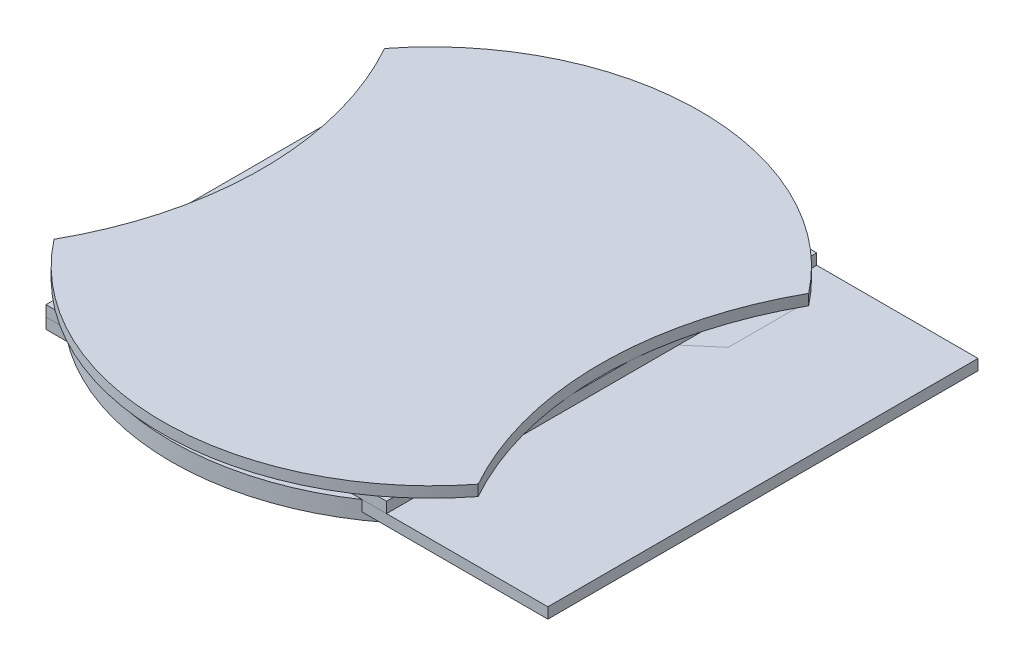
from build123d import *

# Parameters (mm, degrees)
SKETCH1_W                   = 140
SKETCH1_H                   = 120
COMPACT_DEPTH               = 3
SKETCH4_W                   = 95
SKETCH4_H                   = 120
SUPERCOMPACT_DEPTH          = 3
SKETCH7_R                   = 75
APPLE_BASE_DEPTH            = 3
SIDECUTS_DEPTH              = 195.694632694
APPLE_BASE_2_DEPTH          = 3
BOSS_EXTRUDE4_DEPTH         = 3
BASE_PLATE_FILLET_R         = 0.001
TOP_BOTTOM_EXTENSIONS_DEPTH = 3
SKETCH35_R                  = 1.25
SPACERHOLES_DEPTH           = 10
CUT_EXTRUDE4_DEPTH          = 10
SKETCH39_R                  = 72.5
SKETCH39_R_2                = 1.25
BOSS_EXTRUDE5_DEPTH         = 5
CUT_EXTRUDE5_DEPTH          = 150
SKETCH41_R                  = 8.4
CUT_EXTRUDE6_DEPTH          = 10
SKETCH45_R                  = 3.5
CUT_EXTRUDE8_DEPTH          = 12
SKETCH46_R                  = 3.5
CUT_EXTRUDE9_DEPTH          = 10
SKETCH47_R                  = 3.321159562
SKETCH47_R_2                = 3.023678144
SKETCH47_R_3                = 2.802634086
SKETCH47_R_4                = 2.486557649
BOSS_EXTRUDE6_DEPTH         = 5
SKETCH48_R                  = 12.079747328
BOSS_EXTRUDE7_DEPTH         = 5
CUT_EXTRUDE10_DEPTH         = 5
CUT_EXTRUDE11_DEPTH         = 10
BOSS_EXTRUDE9_DEPTH         = 1
BOSS_EXTRUDE9_DEPTH_BACK    = 5
SKETCH52_R                  = 3.9
CHAMFER1_SIZE               = 1
CHAMFER2_SIZE               = 1


with BuildPart() as part:
    # Sketch1 → Compact (new body)
    with BuildSketch(Plane(origin=(0, 0, 0), x_dir=(1, 0, 0), z_dir=(0, 1, 0))):
        with Locations((70, 60)):
            Rectangle(SKETCH1_W, SKETCH1_H)
    extrude(amount=COMPACT_DEPTH)


with BuildPart() as body_2:
    # Sketch4 → SuperCompact (new body)
    with BuildSketch(Plane(origin=(0, 3, 0), x_dir=(1, 0, 0), z_dir=(0, 1, 0))):
        with Locations((47.5, 60)):
            Rectangle(SKETCH4_W, SKETCH4_H)
    extrude(amount=SUPERCOMPACT_DEPTH)


with BuildPart() as body_3:
    # Sketch7 → Apple Base (new body)
    with BuildSketch(Plane(origin=(0, 6, 0), x_dir=(1, 0, 0), z_dir=(0, 1, 0))):
        with Locations(Location((47.5, 60, 0), (0, 0, 270))):
            Circle(SKETCH7_R)
    extrude(amount=APPLE_BASE_DEPTH)

    # Sketch8 → SideCuts (cut, through all)
    with BuildSketch(Plane(origin=(0, 9, 0), x_dir=(1, 0, 0), z_dir=(0, 1, 0))):
        with BuildLine():
            ThreePointArc((-11.66, 106.098746187), (0.350007958, 60), (-11.66, 13.901253813))
            ThreePointArc((-11.66, 13.901253813), (-27.5, 60), (-11.66, 106.098746187))
        make_face()
        with BuildLine():
            ThreePointArc((106.66, 106.098746187), (94.649992042, 60), (106.66, 13.901253813))
            ThreePointArc((106.66, 13.901253813), (122.5, 60), (106.66, 106.098746187))
        make_face()
    extrude(amount=-SIDECUTS_DEPTH, mode=Mode.SUBTRACT)


with BuildPart() as body_4:
    # Sketch9 → Apple_Base 2 (new body)
    with BuildSketch(Plane.XZ.offset(-6)):
        with BuildLine():
            ThreePointArc((106.66, -13.901253813), (47.5, 15), (-11.66, -13.901253813))
            ThreePointArc((-11.66, -13.901253813), (0.350007958, -60), (-11.66, -106.098746187))
            ThreePointArc((-11.66, -106.098746187), (47.5, -135), (106.66, -106.098746187))
            ThreePointArc((106.66, -106.098746187), (94.649992042, -60), (106.66, -13.901253813))
        make_face()
    extrude(amount=APPLE_BASE_2_DEPTH)

    # Sketch10 → Boss-Extrude4 (add)
    with BuildSketch(Plane(origin=(0, 6, 0), x_dir=(1, 0, 0), z_dir=(0, 1, 0))):
        with BuildLine():
            Line((-11.66, 106.098746187), (-11.66, 13.901253813))
            ThreePointArc((-11.66, 13.901253813), (0.350007958, 60), (-11.66, 106.098746187))
        make_face()
        with BuildLine():
            Line((106.66, 106.098746187), (106.66, 13.901253813))
            ThreePointArc((106.66, 13.901253813), (94.649992042, 60), (106.66, 106.098746187))
        make_face()
    extrude(amount=-BOSS_EXTRUDE4_DEPTH)

    # Base_Plate_Fillet
    base_plate_fillet_edges = [body_4.edges().sort_by_distance(p)[0] for p in [
        (-11.66, 3, -60),
        (-11.66, 6, -60),
        (47.5, 3, -135),
        (106.66, 3, -60),
        (106.66, 6, -60),
        (47.5, 6, -135),
        (47.5, 6, 15),
        (106.66, 4.5, -106.098746187),
        (-11.66, 4.5, -106.098746187),
        (-11.66, 4.5, -13.901253813),
        (106.66, 4.5, -13.901253813),
        (47.5, 3, 15),
    ]]
    fillet(base_plate_fillet_edges, radius=BASE_PLATE_FILLET_R)

    # Sketch25 → Top Bottom extensions (add)
    with BuildSketch(Plane(origin=(0, 6, 0), x_dir=(1, 0, 0), z_dir=(0, 1, 0))):
        with BuildLine():
            Line((-11.659005821, 106.097402592), (-11.659005821, 111.097402592))
            ThreePointArc((-11.659005821, 111.097402592), (47.5, 138.794628322), (106.659005821, 111.097402592))
            Line((106.659005821, 111.097402592), (106.659005821, 106.097402592))
            ThreePointArc((106.659005821, 106.097402592), (47.5, 133.794628322), (-11.659005821, 106.097402592))
        make_face()
        with BuildLine():
            Line((106.659005821, 13.902597408), (106.659005821, 8.902597408))
            ThreePointArc((106.659005821, 8.902597408), (47.5, -18.794628322), (-11.659005821, 8.902597408))
            Line((-11.659005821, 8.902597408), (-11.659005821, 13.902597408))
            ThreePointArc((-11.659005821, 13.902597408), (47.5, -13.794628322), (106.659005821, 13.902597408))
        make_face()
    extrude(amount=-TOP_BOTTOM_EXTENSIONS_DEPTH)

    # Sketch35 → SpacerHoles (cut)
    with BuildSketch(Plane.XZ.offset(-3)):
        with Locations(Location((7.5, -5.15, 0), (0, 0, 270))):
            Circle(SKETCH35_R)
        with Locations(Location((87.5, -5.15, 0), (0, 0, 270))):
            Circle(SKETCH35_R)
        with Locations(Location((87.5, -114.85, 0), (0, 0, 270))):
            Circle(SKETCH35_R)
        with Locations(Location((7.5, -114.85, 0), (0, 0, 270))):
            Circle(SKETCH35_R)
    extrude(amount=-SPACERHOLES_DEPTH, mode=Mode.SUBTRACT)

    # Sketch38 → Cut-Extrude4 (cut)
    with BuildSketch(Plane.XZ.offset(-3)):
        Polygon((47.5, 37.050137759), (120.372278362, 37.050137759), (120.372278362, -158.601845129), (-29.177494987, -158.601845129), (-29.177494987, 37.050137759), align=None)
        Polygon((-6.659, -60), (-6.659, 24.702355976), (101.659, 24.702355976), (101.659, -143.843523469), (-6.659, -143.843523469), align=None, mode=Mode.SUBTRACT)
    extrude(amount=-CUT_EXTRUDE4_DEPTH, mode=Mode.SUBTRACT)

    # Sketch39 → Boss-Extrude5 (add)
    with BuildSketch(Plane.XZ.offset(-3)):
        with Locations(Location((47.5, -60, 0), (0, 0, 41.667044295))):
            Circle(SKETCH39_R)
        with Locations(Location((87.5, -5.15, 0), (0, 0, 270))):
            Circle(SKETCH39_R_2, mode=Mode.SUBTRACT)
        with Locations(Location((7.5, -5.15, 0), (0, 0, 270))):
            Circle(SKETCH39_R_2, mode=Mode.SUBTRACT)
        with Locations(Location((7.5, -114.85, 0), (0, 0, 270))):
            Circle(SKETCH39_R_2, mode=Mode.SUBTRACT)
        with Locations(Location((87.5, -114.85, 0), (0, 0, 270))):
            Circle(SKETCH39_R_2, mode=Mode.SUBTRACT)
    extrude(amount=BOSS_EXTRUDE5_DEPTH)

    # Sketch40 → Cut-Extrude5 (cut)
    with BuildSketch(Plane(origin=(101.659, 0, 0), x_dir=(0, 0, -1), z_dir=(1, 0, 0))):
        Polygon((3.460058054, 3), (-22.733784582, 3), (-22.733784582, 8.214035789), (147.50303534, 8.214035789), (147.50303534, 3), align=None)
    extrude(amount=-CUT_EXTRUDE5_DEPTH, mode=Mode.SUBTRACT)

    # Sketch41 → Cut-Extrude6 (cut)
    with BuildSketch(Plane(origin=(0, 3, 0), x_dir=(1, 0, 0), z_dir=(0, 1, 0))):
        with Locations(Location((47.5, 60, 0), (0, 0, 270))):
            Circle(SKETCH41_R)
    extrude(amount=-CUT_EXTRUDE6_DEPTH, mode=Mode.SUBTRACT)

    # Sketch45 → Cut-Extrude8 (cut)
    with BuildSketch(Plane.XZ.offset(2)):
        with Locations(Location((76.961112303, -100.398550245, 0), (0, 0, 270))):
            Circle(SKETCH45_R)
        with Locations(Location((18.038887697, -100.398550245, 0), (0, 0, 270))):
            Circle(SKETCH45_R)
        with Locations(Location((18.038887697, -19.601449755, 0), (0, 0, 270))):
            Circle(SKETCH45_R)
    extrude(amount=-CUT_EXTRUDE8_DEPTH, mode=Mode.SUBTRACT)

    # Sketch46 → Cut-Extrude9 (cut)
    with BuildSketch(Plane.XZ.offset(2)):
        with Locations(Location((76.961112303, -19.601449755, 0), (0, 0, 270))):
            Circle(SKETCH46_R)
    extrude(amount=-CUT_EXTRUDE9_DEPTH, mode=Mode.SUBTRACT)

    # Sketch47 → Boss-Extrude6 (add)
    with BuildSketch(Plane.XZ.offset(2)):
        with Locations((7.5, -5.15)):
            Circle(SKETCH47_R)
        with Locations((87.5, -5.15)):
            Circle(SKETCH47_R_2)
        with Locations((87.5, -114.85)):
            Circle(SKETCH47_R_3)
        with Locations((7.5, -114.85)):
            Circle(SKETCH47_R_4)
    extrude(amount=-BOSS_EXTRUDE6_DEPTH)

    # Sketch48 → Boss-Extrude7 (add)
    with BuildSketch(Plane.XZ.offset(2)):
        with Locations((47.5, -60)):
            Circle(SKETCH48_R)
    extrude(amount=-BOSS_EXTRUDE7_DEPTH)

    # Sketch49 → Cut-Extrude10 (cut)
    with BuildSketch(Plane.XZ.offset(2)):
        Polygon((47.5, -52.75), (41.221315823, -56.375), (41.221315823, -63.625), (47.5, -67.25), (53.778684177, -63.625), (53.778684177, -56.375), align=None)
    extrude(amount=-CUT_EXTRUDE10_DEPTH, mode=Mode.SUBTRACT)

    # Sketch51 → Cut-Extrude11 (cut)
    with BuildSketch(Plane.XZ.offset(2)):
        with BuildLine():
            Line((-7.5, -107.236109069), (-7.5, -60))
            Line((-7.5, -60), (-7.5, -12.763890931))
            ThreePointArc((-7.5, -12.763890931), (-25, -60), (-7.5, -107.236109069))
        make_face()
        with BuildLine():
            Line((102.5, -12.763890931), (102.5, -60))
            Line((102.5, -60), (102.5, -107.236109069))
            ThreePointArc((102.5, -107.236109069), (115.484373204, -85.1868021), (120, -60))
            ThreePointArc((120, -60), (115.484373204, -34.8131979), (102.5, -12.763890931))
        make_face()
    extrude(amount=-CUT_EXTRUDE11_DEPTH, mode=Mode.SUBTRACT)


with BuildPart() as body_5:
    # Sketch52 → Boss-Extrude9 (new, two sides: drawn at the far end of the back side and taken through both)
    with BuildSketch(Plane.XZ.offset(2).offset(-BOSS_EXTRUDE9_DEPTH_BACK)):
        Polygon((53.778684177, -56.375), (47.5, -52.75), (41.221315823, -56.375), (41.221315823, -63.625), (47.5, -67.25), (53.778684177, -63.625), align=None)
        with Locations(Location((47.5, -60, 0), (0, 0, 270))):
            Circle(SKETCH52_R, mode=Mode.SUBTRACT)
    extrude(amount=BOSS_EXTRUDE9_DEPTH + BOSS_EXTRUDE9_DEPTH_BACK)

    # Chamfer1
    chamfer1_edges = [body_5.edges().sort_by_distance(p)[0] for p in [
        (47.5, -3, -56.1),
    ]]
    chamfer(chamfer1_edges, length=CHAMFER1_SIZE)

    # Chamfer2
    chamfer2_edges = [body_5.edges().sort_by_distance(p)[0] for p in [
        (47.5, 3, -56.1),
    ]]
    chamfer(chamfer2_edges, length=CHAMFER2_SIZE)


solid = Compound([part.part, body_2.part, body_3.part, body_4.part, body_5.part])
